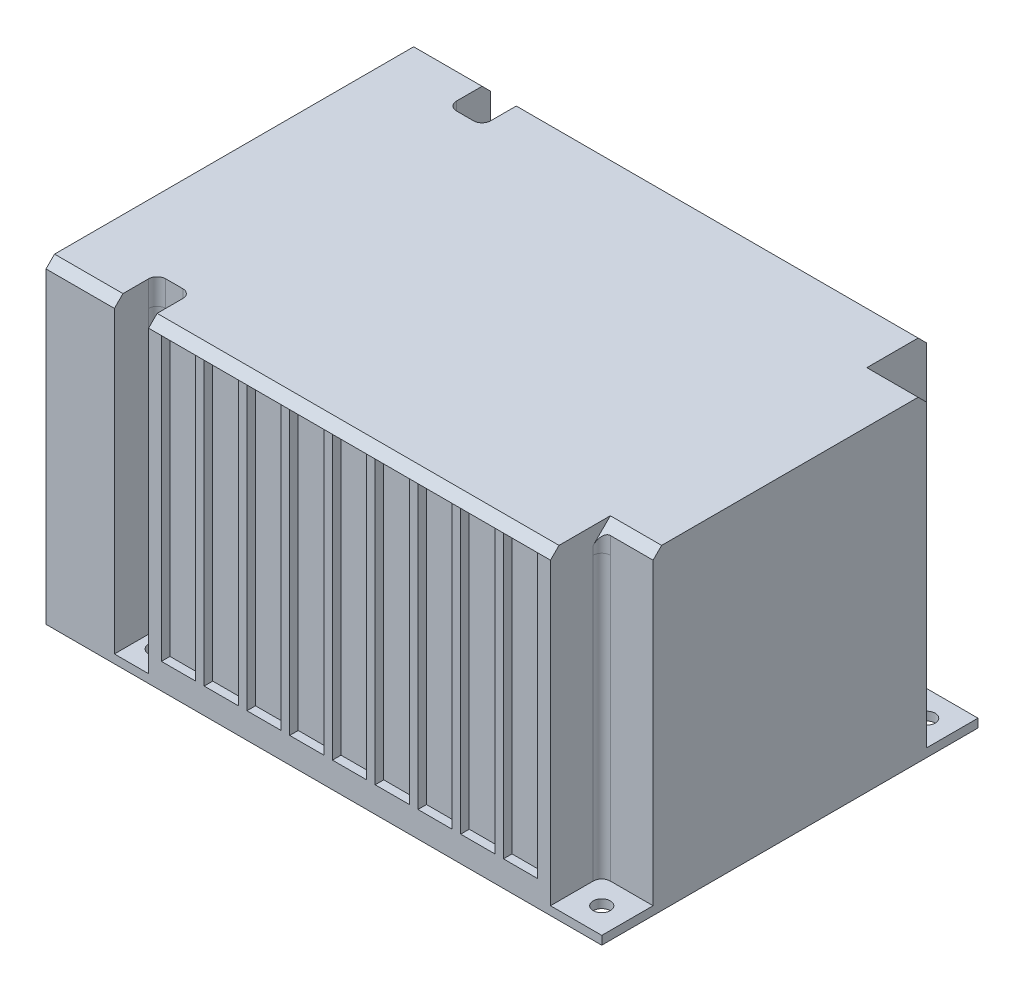
from build123d import *

# Parameters (mm, degrees)
BOSS_EXTRUDE1_DEPTH         = 170
SKETCH3_W                   = 20
SKETCH3_H                   = 25
SKETCH3_W_2                 = 30
SKETCH3_H_2                 = 30
BOSS_EXTRUDE2_DEPTH         = 5
FILLET1_R                   = 5
BOSS_EXTRUDE5_DEPTH         = 15
CHAMFER1_SIZE               = 5
FILLET2_R                   = 5
SKETCH18_W                  = 20
SKETCH18_H                  = 165
CUT_EXTRUDE9_DEPTH          = 5
SKETCH21_W                  = 20
SKETCH21_H                  = 165
CUT_EXTRUDE10_DEPTH         = 5
M4_TAPPED_HOLE1_D           = 3.3
M4_TAPPED_HOLE1_DEPTH       = 5
M4_TAPPED_HOLE1_CSINK_D     = 4.05
M4_TAPPED_HOLE1_CSINK_ANGLE = 90
M4_TAPPED_HOLE1_TIP         = 0.991420021
M6_TAPPED_HOLE1_D           = 5
M6_TAPPED_HOLE1_DEPTH       = 5
M6_TAPPED_HOLE1_CSINK_D     = 6.05
M6_TAPPED_HOLE1_CSINK_ANGLE = 90
M6_TAPPED_HOLE1_TIP         = 1.502151548
M6_TAPPED_HOLE2_D           = 5
M6_TAPPED_HOLE2_DEPTH       = 5
M6_TAPPED_HOLE2_TIP         = 1.502151548
SKETCH31_R                  = 5
CUT_EXTRUDE11_DEPTH         = 267.282275039


with BuildPart() as part:
    # Sketch1 → Boss-Extrude1 (new body)
    with BuildSketch(Plane(origin=(0, 0, 0), x_dir=(1, 0, 0), z_dir=(0, 1, 0))):
        Polygon((162.5, 80), (162.5, -80), (152.5, -80), (147.5, -80), (132.5, -80), (132.5, -95), (132.5, -100), (132.5, -110), (-102.5, -110), (-102.5, -100), (-102.5, -85), (-112.5, -85), (-122.5, -85), (-122.5, -100), (-122.5, -110), (-162.5, -110), (-162.5, -100), (-162.5, -95), (-132.5, -95), (-132.5, -85), (-132.5, -75), (-93.003639463, -75), (-93.003639463, -100), (122.5, -100), (122.5, -70), (152.5, -70), (152.5, 70), (122.5, 70), (122.5, 100), (-93.003639463, 100), (-93.003639463, 75), (-132.5, 75), (-132.5, 85), (-132.5, 95), (-162.5, 95), (-162.5, 100), (-162.5, 110), (-122.5, 110), (-122.5, 100), (-122.5, 85), (-112.5, 85), (-102.5, 85), (-102.5, 100), (-102.5, 110), (132.5, 110), (132.5, 100), (132.5, 95), (132.5, 80), (147.5, 80), (152.5, 80), align=None)
    extrude(amount=BOSS_EXTRUDE1_DEPTH)

    # Sketch3 → Boss-Extrude2 (add)
    with BuildSketch(Plane(origin=(0, 0, 0), x_dir=(1, 0, 0), z_dir=(0, 1, 0))):
        with Locations((-112.5, -97.5)):
            Rectangle(SKETCH3_W, SKETCH3_H)
        Polygon((147.5, -80), (132.5, -80), (132.5, -110), (162.5, -110), (162.5, -80), align=None)
        with Locations((-112.5, 97.5)):
            Rectangle(SKETCH3_W, SKETCH3_H)
        with Locations((147.5, 95)):
            Rectangle(SKETCH3_W_2, SKETCH3_H_2)
    extrude(amount=BOSS_EXTRUDE2_DEPTH)

    # Fillet1
    fillet1_edges = [part.edges().sort_by_distance(p)[0] for p in [
        (-122.5, 87.5, 85),
        (-102.5, 87.5, 85),
        (132.5, 87.5, 80),
        (132.5, 87.5, -80),
        (-102.5, 87.5, -85),
        (-122.5, 87.5, -85),
    ]]
    fillet(fillet1_edges, radius=FILLET1_R)

    # Sketch10 → Boss-Extrude5 (add)
    with BuildSketch(Plane(origin=(0, 170, 0), x_dir=(1, 0, 0), z_dir=(0, 1, 0))):
        Polygon((-162.5, 95), (-162.5, -95), (-162.5, -100), (-162.5, -110), (-122.5, -110), (-122.5, -100), (-122.5, -85), (-112.5, -85), (-102.5, -85), (-102.5, -100), (-102.5, -110), (132.5, -110), (132.5, -100), (132.5, -95), (132.5, -80), (147.5, -80), (152.5, -80), (162.5, -80), (162.5, 80), (152.5, 80), (147.5, 80), (132.5, 80), (132.5, 95), (132.5, 100), (132.5, 110), (-102.5, 110), (-102.5, 100), (-102.5, 85), (-112.5, 85), (-122.5, 85), (-122.5, 100), (-122.5, 110), (-162.5, 110), (-162.5, 100), align=None)
    extrude(amount=BOSS_EXTRUDE5_DEPTH)

    # Chamfer1
    chamfer1_edges = [part.edges().sort_by_distance(p)[0] for p in [
        (147.5, 185, -80),
        (15, 185, -110),
        (-142.5, 185, -110),
        (-142.5, 185, 110),
        (15, 185, 110),
        (147.5, 185, 80),
    ]]
    chamfer(chamfer1_edges, length=CHAMFER1_SIZE)

    # Fillet2
    fillet2_edges = [part.edges().sort_by_distance(p)[0] for p in [
        (-122.5, 177.5, -85),
        (-102.5, 177.5, -85),
        (132.5, 175, -80),
        (132.5, 175, 80),
        (-102.5, 177.5, 85),
        (-122.5, 177.5, 85),
    ]]
    fillet(fillet2_edges, radius=FILLET2_R)

    # Sketch18 → Cut-Extrude9 (cut)
    with BuildSketch(Plane.XY.offset(110)):
        with Locations((-35, 97.5)):
            Rectangle(SKETCH18_W, SKETCH18_H)
        with Locations((-10, 97.5)):
            Rectangle(SKETCH18_W, SKETCH18_H)
        with Locations((15, 97.5)):
            Rectangle(SKETCH18_W, SKETCH18_H)
        with Locations((40, 97.5)):
            Rectangle(SKETCH18_W, SKETCH18_H)
        with Locations((65, 97.5)):
            Rectangle(SKETCH18_W, SKETCH18_H)
        with Locations((90, 97.5)):
            Rectangle(SKETCH18_W, SKETCH18_H)
        with Locations((115, 97.5)):
            Rectangle(SKETCH18_W, SKETCH18_H)
        with Locations((-85, 97.5)):
            Rectangle(SKETCH18_W, SKETCH18_H)
        with Locations((-60, 97.5)):
            Rectangle(SKETCH18_W, SKETCH18_H)
    extrude(amount=-CUT_EXTRUDE9_DEPTH, mode=Mode.SUBTRACT)

    # Sketch21 → Cut-Extrude10 (cut)
    with BuildSketch(Plane(origin=(0, 0, -110), x_dir=(-1, 0, 0), z_dir=(0, 0, -1))):
        with Locations((-90, 97.5)):
            Rectangle(SKETCH21_W, SKETCH21_H)
        with Locations((-65, 97.5)):
            Rectangle(SKETCH21_W, SKETCH21_H)
        with Locations((-40, 97.5)):
            Rectangle(SKETCH21_W, SKETCH21_H)
        with Locations((-15, 97.5)):
            Rectangle(SKETCH21_W, SKETCH21_H)
        with Locations((10, 97.5)):
            Rectangle(SKETCH21_W, SKETCH21_H)
        with Locations((35, 97.5)):
            Rectangle(SKETCH21_W, SKETCH21_H)
        with Locations((60, 97.5)):
            Rectangle(SKETCH21_W, SKETCH21_H)
        with Locations((85, 97.5)):
            Rectangle(SKETCH21_W, SKETCH21_H)
        with Locations((-115, 97.5)):
            Rectangle(SKETCH21_W, SKETCH21_H)
    extrude(amount=-CUT_EXTRUDE10_DEPTH, mode=Mode.SUBTRACT)

    # M4 Tapped Hole1
    with Locations(Plane(origin=(0, 0, 0), x_dir=(-1, 0, 0), z_dir=(0, -1, 0))):
        with Locations((-157.5, 35), (-157.5, -35), (-67.5, -105), (32.5, -105), (32.5, 105), (-67.5, 105)):
            CounterSinkHole(M4_TAPPED_HOLE1_D / 2, M4_TAPPED_HOLE1_CSINK_D / 2, depth=M4_TAPPED_HOLE1_DEPTH, counter_sink_angle=M4_TAPPED_HOLE1_CSINK_ANGLE)
            with Locations((0, 0, -(M4_TAPPED_HOLE1_DEPTH + M4_TAPPED_HOLE1_TIP / 2))):  # 118° drill point
                Cone(0, M4_TAPPED_HOLE1_D / 2, M4_TAPPED_HOLE1_TIP, mode=Mode.SUBTRACT)

    # M6 Tapped Hole1
    with Locations(Plane.ZY.offset(132.5)):
        with Locations((-85, 25), (-85, 165), (85, 165), (85, 25)):
            CounterSinkHole(M6_TAPPED_HOLE1_D / 2, M6_TAPPED_HOLE1_CSINK_D / 2, depth=M6_TAPPED_HOLE1_DEPTH, counter_sink_angle=M6_TAPPED_HOLE1_CSINK_ANGLE)
            with Locations((0, 0, -(M6_TAPPED_HOLE1_DEPTH + M6_TAPPED_HOLE1_TIP / 2))):  # 118° drill point
                Cone(0, M6_TAPPED_HOLE1_D / 2, M6_TAPPED_HOLE1_TIP, mode=Mode.SUBTRACT)

    # M6 Tapped Hole2
    with Locations(Plane.ZY.offset(162.5)):
        with Locations((-102.5, 85), (-102.5, 177.5), (0, 177.5), (102.5, 177.5), (102.5, 85)):
            Hole(M6_TAPPED_HOLE2_D / 2, depth=M6_TAPPED_HOLE2_DEPTH)
            with Locations((0, 0, -(M6_TAPPED_HOLE2_DEPTH + M6_TAPPED_HOLE2_TIP / 2))):  # 118° drill point
                Cone(0, M6_TAPPED_HOLE2_D / 2, M6_TAPPED_HOLE2_TIP, mode=Mode.SUBTRACT)

    # Sketch31 → Cut-Extrude11 (cut, through all)
    with BuildSketch(Plane(origin=(0, 5, 0), x_dir=(1, 0, 0), z_dir=(0, 1, 0))):
        with Locations(Location((147.5, 95, 0), (0, 0, 270))):
            Circle(SKETCH31_R)
        with Locations(Location((-112.5, 95, 0), (0, 0, 270))):
            Circle(SKETCH31_R)
        with Locations(Location((-112.5, -95, 0), (0, 0, 270))):
            Circle(SKETCH31_R)
        with Locations(Location((147.5, -95, 0), (0, 0, 270))):
            Circle(SKETCH31_R)
    extrude(amount=-CUT_EXTRUDE11_DEPTH, mode=Mode.SUBTRACT)


solid = part.part
